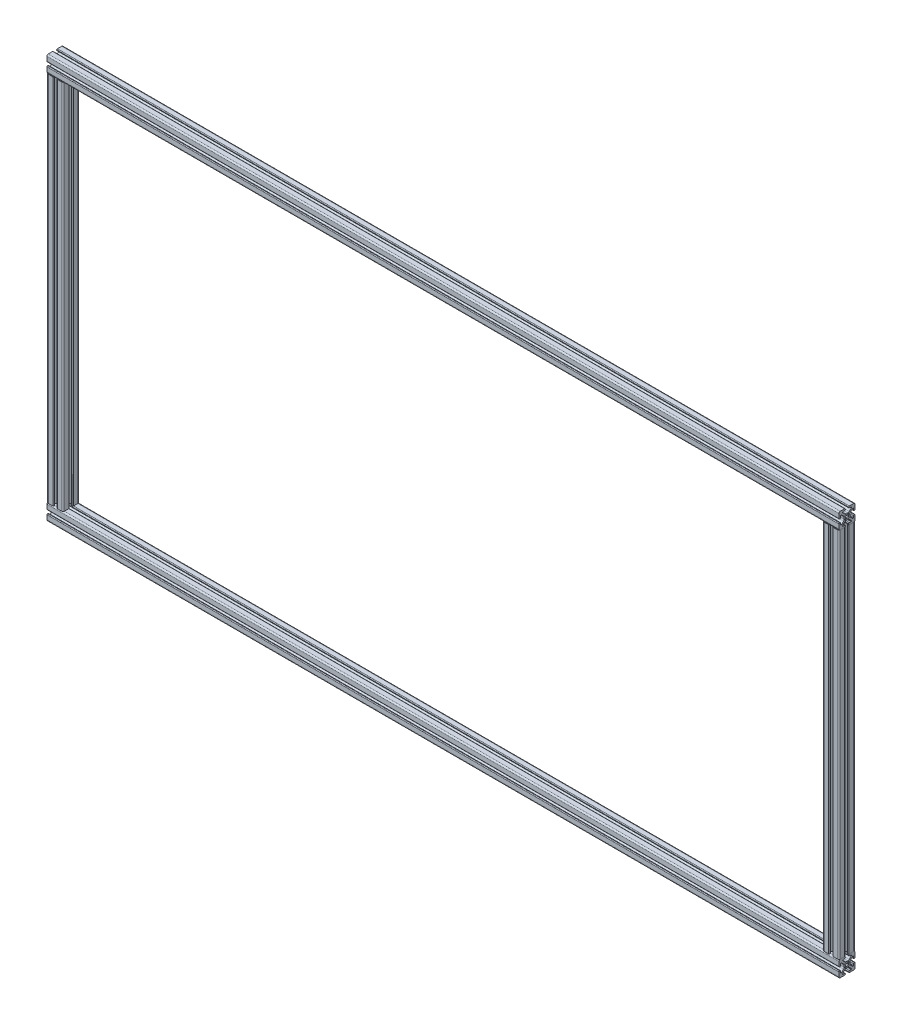
from build123d import *

# Parameters (mm, degrees)
F_15_SERIES_1515_S_BLACK_1_DEPTH      = 1847.85
F_15_SERIES_1515_S_BLACK_1_DEPTH_BACK = 19.05
F_15_SERIES_1515_S_BLACK_1_2_DEPTH    = 1866.9
F_15_SERIES_1515_S_BLACK_1_3_DEPTH    = 916.4
F_15_SERIES_1515_S_BLACK_1_4_DEPTH    = 916.4


with BuildPart() as part:
    # Sketch1 → 15 series 1515-S-BLACK(1) (new, two sides: drawn at the far end of the back side and taken through both)
    with BuildSketch(Plane(origin=(-914.4, 457.2, 0), x_dir=(0, 0, -1), z_dir=(1, 0, 0)).offset(-F_15_SERIES_1515_S_BLACK_1_DEPTH_BACK)):
        with BuildLine():
            Line((-14.986, -9.398), (-14.986, -5.6388))
            ThreePointArc((-14.986, -5.6388), (-15.447248241, -4.525248241), (-16.5608, -4.064))
            Line((-16.5608, -4.064), (-17.4752, -4.064))
            ThreePointArc((-17.4752, -4.064), (-18.588751759, -4.525248241), (-19.05, -5.6388))
            Line((-19.05, -5.6388), (-19.05, -15.875))
            ThreePointArc((-19.05, -15.875), (-18.12006403, -18.12006403), (-15.875, -19.05))
            Line((-15.875, -19.05), (-5.6388, -19.05))
            ThreePointArc((-5.6388, -19.05), (-4.525248241, -18.588751759), (-4.064, -17.4752))
            Line((-4.064, -17.4752), (-4.064, -16.5608))
            ThreePointArc((-4.064, -16.5608), (-4.525248241, -15.447248241), (-5.6388, -14.986))
            Line((-5.6388, -14.986), (-9.398, -14.986))
            ThreePointArc((-9.398, -14.986), (-10.026617928, -14.725617928), (-10.287, -14.097))
            Line((-10.287, -14.097), (-10.287, -13.528918))
            ThreePointArc((-10.287, -13.528918), (-10.219328904, -13.188712428), (-10.026617928, -12.900300071))
            Line((-10.026617928, -12.900300071), (-5.255516832, -8.129198975))
            ThreePointArc((-5.255516832, -8.129198975), (-3.71457081, -7.09957176), (-1.896901043, -6.738014764))
            Line((-1.896901043, -6.738014764), (1.896901043, -6.738014764))
            ThreePointArc((1.896901043, -6.738014764), (3.71457081, -7.09957176), (5.255516832, -8.129198975))
            Line((5.255516832, -8.129198975), (10.026617928, -12.900300071))
            ThreePointArc((10.026617928, -12.900300071), (10.219328904, -13.188712428), (10.287, -13.528918))
            Line((10.287, -13.528918), (10.287, -14.097))
            ThreePointArc((10.287, -14.097), (10.026617928, -14.725617928), (9.398, -14.986))
            Line((9.398, -14.986), (5.6388, -14.986))
            ThreePointArc((5.6388, -14.986), (4.525248241, -15.447248241), (4.064, -16.5608))
            Line((4.064, -16.5608), (4.064, -17.4752))
            ThreePointArc((4.064, -17.4752), (4.525248241, -18.588751759), (5.6388, -19.05))
            Line((5.6388, -19.05), (15.875, -19.05))
            ThreePointArc((15.875, -19.05), (18.12006403, -18.12006403), (19.05, -15.875))
            Line((19.05, -15.875), (19.05, -5.6388))
            ThreePointArc((19.05, -5.6388), (18.588751759, -4.525248241), (17.4752, -4.064))
            Line((17.4752, -4.064), (16.5608, -4.064))
            ThreePointArc((16.5608, -4.064), (15.447248241, -4.525248241), (14.986, -5.6388))
            Line((14.986, -5.6388), (14.986, -9.398))
            ThreePointArc((14.986, -9.398), (14.725617928, -10.026617928), (14.097, -10.287))
            Line((14.097, -10.287), (13.528918, -10.287))
            ThreePointArc((13.528918, -10.287), (13.188712428, -10.219328904), (12.900300071, -10.026617928))
            Line((12.900300071, -10.026617928), (8.129198975, -5.255516832))
            ThreePointArc((8.129198975, -5.255516832), (7.09957176, -3.71457081), (6.738014764, -1.896901043))
            Line((6.738014764, -1.896901043), (6.738014764, 1.896901043))
            ThreePointArc((6.738014764, 1.896901043), (7.09957176, 3.71457081), (8.129198975, 5.255516832))
            Line((8.129198975, 5.255516832), (12.900300071, 10.026617928))
            ThreePointArc((12.900300071, 10.026617928), (13.188712428, 10.219328904), (13.528918, 10.287))
            Line((13.528918, 10.287), (14.097, 10.287))
            ThreePointArc((14.097, 10.287), (14.725617928, 10.026617928), (14.986, 9.398))
            Line((14.986, 9.398), (14.986, 5.6388))
            ThreePointArc((14.986, 5.6388), (15.447248241, 4.525248241), (16.5608, 4.064))
            Line((16.5608, 4.064), (17.4752, 4.064))
            ThreePointArc((17.4752, 4.064), (18.588751759, 4.525248241), (19.05, 5.6388))
            Line((19.05, 5.6388), (19.05, 15.875))
            ThreePointArc((19.05, 15.875), (18.12006403, 18.12006403), (15.875, 19.05))
            Line((15.875, 19.05), (5.6388, 19.05))
            ThreePointArc((5.6388, 19.05), (4.525248241, 18.588751759), (4.064, 17.4752))
            Line((4.064, 17.4752), (4.064, 16.5608))
            ThreePointArc((4.064, 16.5608), (4.525248241, 15.447248241), (5.6388, 14.986))
            Line((5.6388, 14.986), (9.398, 14.986))
            ThreePointArc((9.398, 14.986), (10.026617928, 14.725617928), (10.287, 14.097))
            Line((10.287, 14.097), (10.287, 13.528918))
            ThreePointArc((10.287, 13.528918), (10.219328904, 13.188712428), (10.026617928, 12.900300071))
            Line((10.026617928, 12.900300071), (5.255516832, 8.129198975))
            ThreePointArc((5.255516832, 8.129198975), (3.71457081, 7.09957176), (1.896901043, 6.738014764))
            Line((1.896901043, 6.738014764), (-1.896901043, 6.738014764))
            ThreePointArc((-1.896901043, 6.738014764), (-3.71457081, 7.09957176), (-5.255516832, 8.129198975))
            Line((-5.255516832, 8.129198975), (-10.026617928, 12.900300071))
            ThreePointArc((-10.026617928, 12.900300071), (-10.219328904, 13.188712428), (-10.287, 13.528918))
            Line((-10.287, 13.528918), (-10.287, 14.097))
            ThreePointArc((-10.287, 14.097), (-10.026617928, 14.725617928), (-9.398, 14.986))
            Line((-9.398, 14.986), (-5.6388, 14.986))
            ThreePointArc((-5.6388, 14.986), (-4.525248241, 15.447248241), (-4.064, 16.5608))
            Line((-4.064, 16.5608), (-4.064, 17.4752))
            ThreePointArc((-4.064, 17.4752), (-4.525248241, 18.588751759), (-5.6388, 19.05))
            Line((-5.6388, 19.05), (-15.875, 19.05))
            ThreePointArc((-15.875, 19.05), (-18.12006403, 18.12006403), (-19.05, 15.875))
            Line((-19.05, 15.875), (-19.05, 5.6388))
            ThreePointArc((-19.05, 5.6388), (-18.588751759, 4.525248241), (-17.4752, 4.064))
            Line((-17.4752, 4.064), (-16.5608, 4.064))
            ThreePointArc((-16.5608, 4.064), (-15.447248241, 4.525248241), (-14.986, 5.6388))
            Line((-14.986, 5.6388), (-14.986, 9.398))
            ThreePointArc((-14.986, 9.398), (-14.725617928, 10.026617928), (-14.097, 10.287))
            Line((-14.097, 10.287), (-13.528918, 10.287))
            ThreePointArc((-13.528918, 10.287), (-13.188712428, 10.219328904), (-12.900300071, 10.026617928))
            Line((-12.900300071, 10.026617928), (-8.129198975, 5.255516832))
            ThreePointArc((-8.129198975, 5.255516832), (-7.09957176, 3.71457081), (-6.738014764, 1.896901043))
            Line((-6.738014764, 1.896901043), (-6.738014764, -1.896901043))
            ThreePointArc((-6.738014764, -1.896901043), (-7.09957176, -3.71457081), (-8.129198975, -5.255516832))
            Line((-8.129198975, -5.255516832), (-12.900300071, -10.026617928))
            ThreePointArc((-12.900300071, -10.026617928), (-13.188712428, -10.219328904), (-13.528918, -10.287))
            Line((-13.528918, -10.287), (-14.097, -10.287))
            ThreePointArc((-14.097, -10.287), (-14.725617928, -10.026617928), (-14.986, -9.398))
        make_face()
        with BuildLine():
            Line((-3.017877069, 1.401430967), (-4.338823051, 2.722376949))
            ThreePointArc((-4.338823051, 2.722376949), (-4.338823051, 4.338823051), (-2.722376949, 4.338823051))
            Line((-2.722376949, 4.338823051), (-1.401430967, 3.017877069))
            ThreePointArc((-1.401430967, 3.017877069), (0, 3.3274), (1.401430967, 3.017877069))
            Line((1.401430967, 3.017877069), (2.722376949, 4.338823051))
            ThreePointArc((2.722376949, 4.338823051), (4.338823051, 4.338823051), (4.338823051, 2.722376949))
            Line((4.338823051, 2.722376949), (3.017877069, 1.401430967))
            ThreePointArc((3.017877069, 1.401430967), (3.3274, 0), (3.017877069, -1.401430967))
            Line((3.017877069, -1.401430967), (4.338823051, -2.722376949))
            ThreePointArc((4.338823051, -2.722376949), (4.338823051, -4.338823051), (2.722376949, -4.338823051))
            Line((2.722376949, -4.338823051), (1.401430967, -3.017877069))
            ThreePointArc((1.401430967, -3.017877069), (0, -3.3274), (-1.401430967, -3.017877069))
            Line((-1.401430967, -3.017877069), (-2.722376949, -4.338823051))
            ThreePointArc((-2.722376949, -4.338823051), (-4.338823051, -4.338823051), (-4.338823051, -2.722376949))
            Line((-4.338823051, -2.722376949), (-3.017877069, -1.401430967))
            ThreePointArc((-3.017877069, -1.401430967), (-3.3274, 0), (-3.017877069, 1.401430967))
        make_face(mode=Mode.SUBTRACT)
    extrude(amount=F_15_SERIES_1515_S_BLACK_1_DEPTH + F_15_SERIES_1515_S_BLACK_1_DEPTH_BACK)


with BuildPart() as body_2:
    # Sketch1 on segment 2 (carried to segment 2) → 15 series 1515-S-BLACK_1 2 (new body)
    with BuildSketch(Plane(origin=(-933.45, -457.2, 0), x_dir=(0, 0, -1), z_dir=(1, 0, 0))):
        with BuildLine():
            Line((-14.986, -9.398), (-14.986, -5.6388))
            ThreePointArc((-14.986, -5.6388), (-15.447248241, -4.525248241), (-16.5608, -4.064))
            Line((-16.5608, -4.064), (-17.4752, -4.064))
            ThreePointArc((-17.4752, -4.064), (-18.588751759, -4.525248241), (-19.05, -5.6388))
            Line((-19.05, -5.6388), (-19.05, -15.875))
            ThreePointArc((-19.05, -15.875), (-18.12006403, -18.12006403), (-15.875, -19.05))
            Line((-15.875, -19.05), (-5.6388, -19.05))
            ThreePointArc((-5.6388, -19.05), (-4.525248241, -18.588751759), (-4.064, -17.4752))
            Line((-4.064, -17.4752), (-4.064, -16.5608))
            ThreePointArc((-4.064, -16.5608), (-4.525248241, -15.447248241), (-5.6388, -14.986))
            Line((-5.6388, -14.986), (-9.398, -14.986))
            ThreePointArc((-9.398, -14.986), (-10.026617928, -14.725617928), (-10.287, -14.097))
            Line((-10.287, -14.097), (-10.287, -13.528918))
            ThreePointArc((-10.287, -13.528918), (-10.219328904, -13.188712428), (-10.026617928, -12.900300071))
            Line((-10.026617928, -12.900300071), (-5.255516832, -8.129198975))
            ThreePointArc((-5.255516832, -8.129198975), (-3.71457081, -7.09957176), (-1.896901043, -6.738014764))
            Line((-1.896901043, -6.738014764), (1.896901043, -6.738014764))
            ThreePointArc((1.896901043, -6.738014764), (3.71457081, -7.09957176), (5.255516832, -8.129198975))
            Line((5.255516832, -8.129198975), (10.026617928, -12.900300071))
            ThreePointArc((10.026617928, -12.900300071), (10.219328904, -13.188712428), (10.287, -13.528918))
            Line((10.287, -13.528918), (10.287, -14.097))
            ThreePointArc((10.287, -14.097), (10.026617928, -14.725617928), (9.398, -14.986))
            Line((9.398, -14.986), (5.6388, -14.986))
            ThreePointArc((5.6388, -14.986), (4.525248241, -15.447248241), (4.064, -16.5608))
            Line((4.064, -16.5608), (4.064, -17.4752))
            ThreePointArc((4.064, -17.4752), (4.525248241, -18.588751759), (5.6388, -19.05))
            Line((5.6388, -19.05), (15.875, -19.05))
            ThreePointArc((15.875, -19.05), (18.12006403, -18.12006403), (19.05, -15.875))
            Line((19.05, -15.875), (19.05, -5.6388))
            ThreePointArc((19.05, -5.6388), (18.588751759, -4.525248241), (17.4752, -4.064))
            Line((17.4752, -4.064), (16.5608, -4.064))
            ThreePointArc((16.5608, -4.064), (15.447248241, -4.525248241), (14.986, -5.6388))
            Line((14.986, -5.6388), (14.986, -9.398))
            ThreePointArc((14.986, -9.398), (14.725617928, -10.026617928), (14.097, -10.287))
            Line((14.097, -10.287), (13.528918, -10.287))
            ThreePointArc((13.528918, -10.287), (13.188712428, -10.219328904), (12.900300071, -10.026617928))
            Line((12.900300071, -10.026617928), (8.129198975, -5.255516832))
            ThreePointArc((8.129198975, -5.255516832), (7.09957176, -3.71457081), (6.738014764, -1.896901043))
            Line((6.738014764, -1.896901043), (6.738014764, 1.896901043))
            ThreePointArc((6.738014764, 1.896901043), (7.09957176, 3.71457081), (8.129198975, 5.255516832))
            Line((8.129198975, 5.255516832), (12.900300071, 10.026617928))
            ThreePointArc((12.900300071, 10.026617928), (13.188712428, 10.219328904), (13.528918, 10.287))
            Line((13.528918, 10.287), (14.097, 10.287))
            ThreePointArc((14.097, 10.287), (14.725617928, 10.026617928), (14.986, 9.398))
            Line((14.986, 9.398), (14.986, 5.6388))
            ThreePointArc((14.986, 5.6388), (15.447248241, 4.525248241), (16.5608, 4.064))
            Line((16.5608, 4.064), (17.4752, 4.064))
            ThreePointArc((17.4752, 4.064), (18.588751759, 4.525248241), (19.05, 5.6388))
            Line((19.05, 5.6388), (19.05, 15.875))
            ThreePointArc((19.05, 15.875), (18.12006403, 18.12006403), (15.875, 19.05))
            Line((15.875, 19.05), (5.6388, 19.05))
            ThreePointArc((5.6388, 19.05), (4.525248241, 18.588751759), (4.064, 17.4752))
            Line((4.064, 17.4752), (4.064, 16.5608))
            ThreePointArc((4.064, 16.5608), (4.525248241, 15.447248241), (5.6388, 14.986))
            Line((5.6388, 14.986), (9.398, 14.986))
            ThreePointArc((9.398, 14.986), (10.026617928, 14.725617928), (10.287, 14.097))
            Line((10.287, 14.097), (10.287, 13.528918))
            ThreePointArc((10.287, 13.528918), (10.219328904, 13.188712428), (10.026617928, 12.900300071))
            Line((10.026617928, 12.900300071), (5.255516832, 8.129198975))
            ThreePointArc((5.255516832, 8.129198975), (3.71457081, 7.09957176), (1.896901043, 6.738014764))
            Line((1.896901043, 6.738014764), (-1.896901043, 6.738014764))
            ThreePointArc((-1.896901043, 6.738014764), (-3.71457081, 7.09957176), (-5.255516832, 8.129198975))
            Line((-5.255516832, 8.129198975), (-10.026617928, 12.900300071))
            ThreePointArc((-10.026617928, 12.900300071), (-10.219328904, 13.188712428), (-10.287, 13.528918))
            Line((-10.287, 13.528918), (-10.287, 14.097))
            ThreePointArc((-10.287, 14.097), (-10.026617928, 14.725617928), (-9.398, 14.986))
            Line((-9.398, 14.986), (-5.6388, 14.986))
            ThreePointArc((-5.6388, 14.986), (-4.525248241, 15.447248241), (-4.064, 16.5608))
            Line((-4.064, 16.5608), (-4.064, 17.4752))
            ThreePointArc((-4.064, 17.4752), (-4.525248241, 18.588751759), (-5.6388, 19.05))
            Line((-5.6388, 19.05), (-15.875, 19.05))
            ThreePointArc((-15.875, 19.05), (-18.12006403, 18.12006403), (-19.05, 15.875))
            Line((-19.05, 15.875), (-19.05, 5.6388))
            ThreePointArc((-19.05, 5.6388), (-18.588751759, 4.525248241), (-17.4752, 4.064))
            Line((-17.4752, 4.064), (-16.5608, 4.064))
            ThreePointArc((-16.5608, 4.064), (-15.447248241, 4.525248241), (-14.986, 5.6388))
            Line((-14.986, 5.6388), (-14.986, 9.398))
            ThreePointArc((-14.986, 9.398), (-14.725617928, 10.026617928), (-14.097, 10.287))
            Line((-14.097, 10.287), (-13.528918, 10.287))
            ThreePointArc((-13.528918, 10.287), (-13.188712428, 10.219328904), (-12.900300071, 10.026617928))
            Line((-12.900300071, 10.026617928), (-8.129198975, 5.255516832))
            ThreePointArc((-8.129198975, 5.255516832), (-7.09957176, 3.71457081), (-6.738014764, 1.896901043))
            Line((-6.738014764, 1.896901043), (-6.738014764, -1.896901043))
            ThreePointArc((-6.738014764, -1.896901043), (-7.09957176, -3.71457081), (-8.129198975, -5.255516832))
            Line((-8.129198975, -5.255516832), (-12.900300071, -10.026617928))
            ThreePointArc((-12.900300071, -10.026617928), (-13.188712428, -10.219328904), (-13.528918, -10.287))
            Line((-13.528918, -10.287), (-14.097, -10.287))
            ThreePointArc((-14.097, -10.287), (-14.725617928, -10.026617928), (-14.986, -9.398))
        make_face()
        with BuildLine():
            Line((-3.017877069, 1.401430967), (-4.338823051, 2.722376949))
            ThreePointArc((-4.338823051, 2.722376949), (-4.338823051, 4.338823051), (-2.722376949, 4.338823051))
            Line((-2.722376949, 4.338823051), (-1.401430967, 3.017877069))
            ThreePointArc((-1.401430967, 3.017877069), (0, 3.3274), (1.401430967, 3.017877069))
            Line((1.401430967, 3.017877069), (2.722376949, 4.338823051))
            ThreePointArc((2.722376949, 4.338823051), (4.338823051, 4.338823051), (4.338823051, 2.722376949))
            Line((4.338823051, 2.722376949), (3.017877069, 1.401430967))
            ThreePointArc((3.017877069, 1.401430967), (3.3274, 0), (3.017877069, -1.401430967))
            Line((3.017877069, -1.401430967), (4.338823051, -2.722376949))
            ThreePointArc((4.338823051, -2.722376949), (4.338823051, -4.338823051), (2.722376949, -4.338823051))
            Line((2.722376949, -4.338823051), (1.401430967, -3.017877069))
            ThreePointArc((1.401430967, -3.017877069), (0, -3.3274), (-1.401430967, -3.017877069))
            Line((-1.401430967, -3.017877069), (-2.722376949, -4.338823051))
            ThreePointArc((-2.722376949, -4.338823051), (-4.338823051, -4.338823051), (-4.338823051, -2.722376949))
            Line((-4.338823051, -2.722376949), (-3.017877069, -1.401430967))
            ThreePointArc((-3.017877069, -1.401430967), (-3.3274, 0), (-3.017877069, 1.401430967))
        make_face(mode=Mode.SUBTRACT)
    extrude(amount=F_15_SERIES_1515_S_BLACK_1_2_DEPTH)


with BuildPart() as body_3:
    # Sketch1 on segment 3 (carried to segment 3) → 15 series 1515-S-BLACK_1 3 (new body)
    with BuildSketch(Plane(origin=(-914.4, -458.2, 0), x_dir=(0, 0, -1), z_dir=(0, 1, 0))):
        with BuildLine():
            Line((-14.986, -9.398), (-14.986, -5.6388))
            ThreePointArc((-14.986, -5.6388), (-15.447248241, -4.525248241), (-16.5608, -4.064))
            Line((-16.5608, -4.064), (-17.4752, -4.064))
            ThreePointArc((-17.4752, -4.064), (-18.588751759, -4.525248241), (-19.05, -5.6388))
            Line((-19.05, -5.6388), (-19.05, -15.875))
            ThreePointArc((-19.05, -15.875), (-18.12006403, -18.12006403), (-15.875, -19.05))
            Line((-15.875, -19.05), (-5.6388, -19.05))
            ThreePointArc((-5.6388, -19.05), (-4.525248241, -18.588751759), (-4.064, -17.4752))
            Line((-4.064, -17.4752), (-4.064, -16.5608))
            ThreePointArc((-4.064, -16.5608), (-4.525248241, -15.447248241), (-5.6388, -14.986))
            Line((-5.6388, -14.986), (-9.398, -14.986))
            ThreePointArc((-9.398, -14.986), (-10.026617928, -14.725617928), (-10.287, -14.097))
            Line((-10.287, -14.097), (-10.287, -13.528918))
            ThreePointArc((-10.287, -13.528918), (-10.219328904, -13.188712428), (-10.026617928, -12.900300071))
            Line((-10.026617928, -12.900300071), (-5.255516832, -8.129198975))
            ThreePointArc((-5.255516832, -8.129198975), (-3.71457081, -7.09957176), (-1.896901043, -6.738014764))
            Line((-1.896901043, -6.738014764), (1.896901043, -6.738014764))
            ThreePointArc((1.896901043, -6.738014764), (3.71457081, -7.09957176), (5.255516832, -8.129198975))
            Line((5.255516832, -8.129198975), (10.026617928, -12.900300071))
            ThreePointArc((10.026617928, -12.900300071), (10.219328904, -13.188712428), (10.287, -13.528918))
            Line((10.287, -13.528918), (10.287, -14.097))
            ThreePointArc((10.287, -14.097), (10.026617928, -14.725617928), (9.398, -14.986))
            Line((9.398, -14.986), (5.6388, -14.986))
            ThreePointArc((5.6388, -14.986), (4.525248241, -15.447248241), (4.064, -16.5608))
            Line((4.064, -16.5608), (4.064, -17.4752))
            ThreePointArc((4.064, -17.4752), (4.525248241, -18.588751759), (5.6388, -19.05))
            Line((5.6388, -19.05), (15.875, -19.05))
            ThreePointArc((15.875, -19.05), (18.12006403, -18.12006403), (19.05, -15.875))
            Line((19.05, -15.875), (19.05, -5.6388))
            ThreePointArc((19.05, -5.6388), (18.588751759, -4.525248241), (17.4752, -4.064))
            Line((17.4752, -4.064), (16.5608, -4.064))
            ThreePointArc((16.5608, -4.064), (15.447248241, -4.525248241), (14.986, -5.6388))
            Line((14.986, -5.6388), (14.986, -9.398))
            ThreePointArc((14.986, -9.398), (14.725617928, -10.026617928), (14.097, -10.287))
            Line((14.097, -10.287), (13.528918, -10.287))
            ThreePointArc((13.528918, -10.287), (13.188712428, -10.219328904), (12.900300071, -10.026617928))
            Line((12.900300071, -10.026617928), (8.129198975, -5.255516832))
            ThreePointArc((8.129198975, -5.255516832), (7.09957176, -3.71457081), (6.738014764, -1.896901043))
            Line((6.738014764, -1.896901043), (6.738014764, 1.896901043))
            ThreePointArc((6.738014764, 1.896901043), (7.09957176, 3.71457081), (8.129198975, 5.255516832))
            Line((8.129198975, 5.255516832), (12.900300071, 10.026617928))
            ThreePointArc((12.900300071, 10.026617928), (13.188712428, 10.219328904), (13.528918, 10.287))
            Line((13.528918, 10.287), (14.097, 10.287))
            ThreePointArc((14.097, 10.287), (14.725617928, 10.026617928), (14.986, 9.398))
            Line((14.986, 9.398), (14.986, 5.6388))
            ThreePointArc((14.986, 5.6388), (15.447248241, 4.525248241), (16.5608, 4.064))
            Line((16.5608, 4.064), (17.4752, 4.064))
            ThreePointArc((17.4752, 4.064), (18.588751759, 4.525248241), (19.05, 5.6388))
            Line((19.05, 5.6388), (19.05, 15.875))
            ThreePointArc((19.05, 15.875), (18.12006403, 18.12006403), (15.875, 19.05))
            Line((15.875, 19.05), (5.6388, 19.05))
            ThreePointArc((5.6388, 19.05), (4.525248241, 18.588751759), (4.064, 17.4752))
            Line((4.064, 17.4752), (4.064, 16.5608))
            ThreePointArc((4.064, 16.5608), (4.525248241, 15.447248241), (5.6388, 14.986))
            Line((5.6388, 14.986), (9.398, 14.986))
            ThreePointArc((9.398, 14.986), (10.026617928, 14.725617928), (10.287, 14.097))
            Line((10.287, 14.097), (10.287, 13.528918))
            ThreePointArc((10.287, 13.528918), (10.219328904, 13.188712428), (10.026617928, 12.900300071))
            Line((10.026617928, 12.900300071), (5.255516832, 8.129198975))
            ThreePointArc((5.255516832, 8.129198975), (3.71457081, 7.09957176), (1.896901043, 6.738014764))
            Line((1.896901043, 6.738014764), (-1.896901043, 6.738014764))
            ThreePointArc((-1.896901043, 6.738014764), (-3.71457081, 7.09957176), (-5.255516832, 8.129198975))
            Line((-5.255516832, 8.129198975), (-10.026617928, 12.900300071))
            ThreePointArc((-10.026617928, 12.900300071), (-10.219328904, 13.188712428), (-10.287, 13.528918))
            Line((-10.287, 13.528918), (-10.287, 14.097))
            ThreePointArc((-10.287, 14.097), (-10.026617928, 14.725617928), (-9.398, 14.986))
            Line((-9.398, 14.986), (-5.6388, 14.986))
            ThreePointArc((-5.6388, 14.986), (-4.525248241, 15.447248241), (-4.064, 16.5608))
            Line((-4.064, 16.5608), (-4.064, 17.4752))
            ThreePointArc((-4.064, 17.4752), (-4.525248241, 18.588751759), (-5.6388, 19.05))
            Line((-5.6388, 19.05), (-15.875, 19.05))
            ThreePointArc((-15.875, 19.05), (-18.12006403, 18.12006403), (-19.05, 15.875))
            Line((-19.05, 15.875), (-19.05, 5.6388))
            ThreePointArc((-19.05, 5.6388), (-18.588751759, 4.525248241), (-17.4752, 4.064))
            Line((-17.4752, 4.064), (-16.5608, 4.064))
            ThreePointArc((-16.5608, 4.064), (-15.447248241, 4.525248241), (-14.986, 5.6388))
            Line((-14.986, 5.6388), (-14.986, 9.398))
            ThreePointArc((-14.986, 9.398), (-14.725617928, 10.026617928), (-14.097, 10.287))
            Line((-14.097, 10.287), (-13.528918, 10.287))
            ThreePointArc((-13.528918, 10.287), (-13.188712428, 10.219328904), (-12.900300071, 10.026617928))
            Line((-12.900300071, 10.026617928), (-8.129198975, 5.255516832))
            ThreePointArc((-8.129198975, 5.255516832), (-7.09957176, 3.71457081), (-6.738014764, 1.896901043))
            Line((-6.738014764, 1.896901043), (-6.738014764, -1.896901043))
            ThreePointArc((-6.738014764, -1.896901043), (-7.09957176, -3.71457081), (-8.129198975, -5.255516832))
            Line((-8.129198975, -5.255516832), (-12.900300071, -10.026617928))
            ThreePointArc((-12.900300071, -10.026617928), (-13.188712428, -10.219328904), (-13.528918, -10.287))
            Line((-13.528918, -10.287), (-14.097, -10.287))
            ThreePointArc((-14.097, -10.287), (-14.725617928, -10.026617928), (-14.986, -9.398))
        make_face()
        with BuildLine():
            Line((-3.017877069, 1.401430967), (-4.338823051, 2.722376949))
            ThreePointArc((-4.338823051, 2.722376949), (-4.338823051, 4.338823051), (-2.722376949, 4.338823051))
            Line((-2.722376949, 4.338823051), (-1.401430967, 3.017877069))
            ThreePointArc((-1.401430967, 3.017877069), (0, 3.3274), (1.401430967, 3.017877069))
            Line((1.401430967, 3.017877069), (2.722376949, 4.338823051))
            ThreePointArc((2.722376949, 4.338823051), (4.338823051, 4.338823051), (4.338823051, 2.722376949))
            Line((4.338823051, 2.722376949), (3.017877069, 1.401430967))
            ThreePointArc((3.017877069, 1.401430967), (3.3274, 0), (3.017877069, -1.401430967))
            Line((3.017877069, -1.401430967), (4.338823051, -2.722376949))
            ThreePointArc((4.338823051, -2.722376949), (4.338823051, -4.338823051), (2.722376949, -4.338823051))
            Line((2.722376949, -4.338823051), (1.401430967, -3.017877069))
            ThreePointArc((1.401430967, -3.017877069), (0, -3.3274), (-1.401430967, -3.017877069))
            Line((-1.401430967, -3.017877069), (-2.722376949, -4.338823051))
            ThreePointArc((-2.722376949, -4.338823051), (-4.338823051, -4.338823051), (-4.338823051, -2.722376949))
            Line((-4.338823051, -2.722376949), (-3.017877069, -1.401430967))
            ThreePointArc((-3.017877069, -1.401430967), (-3.3274, 0), (-3.017877069, 1.401430967))
        make_face(mode=Mode.SUBTRACT)
    extrude(amount=F_15_SERIES_1515_S_BLACK_1_3_DEPTH)

    # 15 series 1515-S-BLACK_1 3 end butt 1
    split(bisect_by=Plane(origin=(-914.4, -438.15, 0), x_dir=(-1, 0, 0), z_dir=(0, 1, 0)), keep=Keep.TOP)

    # 15 series 1515-S-BLACK_1 3 end butt 2
    split(bisect_by=Plane(origin=(-914.4, 438.15, 0), x_dir=(1, 0, 0), z_dir=(0, -1, 0)), keep=Keep.TOP)


with BuildPart() as body_4:
    # Sketch1 on segment 4 (carried to segment 4) → 15 series 1515-S-BLACK_1 4 (new body)
    with BuildSketch(Plane(origin=(914.4, -458.2, 0), x_dir=(0, 0, -1), z_dir=(0, 1, 0))):
        with BuildLine():
            Line((-14.986, -9.398), (-14.986, -5.6388))
            ThreePointArc((-14.986, -5.6388), (-15.447248241, -4.525248241), (-16.5608, -4.064))
            Line((-16.5608, -4.064), (-17.4752, -4.064))
            ThreePointArc((-17.4752, -4.064), (-18.588751759, -4.525248241), (-19.05, -5.6388))
            Line((-19.05, -5.6388), (-19.05, -15.875))
            ThreePointArc((-19.05, -15.875), (-18.12006403, -18.12006403), (-15.875, -19.05))
            Line((-15.875, -19.05), (-5.6388, -19.05))
            ThreePointArc((-5.6388, -19.05), (-4.525248241, -18.588751759), (-4.064, -17.4752))
            Line((-4.064, -17.4752), (-4.064, -16.5608))
            ThreePointArc((-4.064, -16.5608), (-4.525248241, -15.447248241), (-5.6388, -14.986))
            Line((-5.6388, -14.986), (-9.398, -14.986))
            ThreePointArc((-9.398, -14.986), (-10.026617928, -14.725617928), (-10.287, -14.097))
            Line((-10.287, -14.097), (-10.287, -13.528918))
            ThreePointArc((-10.287, -13.528918), (-10.219328904, -13.188712428), (-10.026617928, -12.900300071))
            Line((-10.026617928, -12.900300071), (-5.255516832, -8.129198975))
            ThreePointArc((-5.255516832, -8.129198975), (-3.71457081, -7.09957176), (-1.896901043, -6.738014764))
            Line((-1.896901043, -6.738014764), (1.896901043, -6.738014764))
            ThreePointArc((1.896901043, -6.738014764), (3.71457081, -7.09957176), (5.255516832, -8.129198975))
            Line((5.255516832, -8.129198975), (10.026617928, -12.900300071))
            ThreePointArc((10.026617928, -12.900300071), (10.219328904, -13.188712428), (10.287, -13.528918))
            Line((10.287, -13.528918), (10.287, -14.097))
            ThreePointArc((10.287, -14.097), (10.026617928, -14.725617928), (9.398, -14.986))
            Line((9.398, -14.986), (5.6388, -14.986))
            ThreePointArc((5.6388, -14.986), (4.525248241, -15.447248241), (4.064, -16.5608))
            Line((4.064, -16.5608), (4.064, -17.4752))
            ThreePointArc((4.064, -17.4752), (4.525248241, -18.588751759), (5.6388, -19.05))
            Line((5.6388, -19.05), (15.875, -19.05))
            ThreePointArc((15.875, -19.05), (18.12006403, -18.12006403), (19.05, -15.875))
            Line((19.05, -15.875), (19.05, -5.6388))
            ThreePointArc((19.05, -5.6388), (18.588751759, -4.525248241), (17.4752, -4.064))
            Line((17.4752, -4.064), (16.5608, -4.064))
            ThreePointArc((16.5608, -4.064), (15.447248241, -4.525248241), (14.986, -5.6388))
            Line((14.986, -5.6388), (14.986, -9.398))
            ThreePointArc((14.986, -9.398), (14.725617928, -10.026617928), (14.097, -10.287))
            Line((14.097, -10.287), (13.528918, -10.287))
            ThreePointArc((13.528918, -10.287), (13.188712428, -10.219328904), (12.900300071, -10.026617928))
            Line((12.900300071, -10.026617928), (8.129198975, -5.255516832))
            ThreePointArc((8.129198975, -5.255516832), (7.09957176, -3.71457081), (6.738014764, -1.896901043))
            Line((6.738014764, -1.896901043), (6.738014764, 1.896901043))
            ThreePointArc((6.738014764, 1.896901043), (7.09957176, 3.71457081), (8.129198975, 5.255516832))
            Line((8.129198975, 5.255516832), (12.900300071, 10.026617928))
            ThreePointArc((12.900300071, 10.026617928), (13.188712428, 10.219328904), (13.528918, 10.287))
            Line((13.528918, 10.287), (14.097, 10.287))
            ThreePointArc((14.097, 10.287), (14.725617928, 10.026617928), (14.986, 9.398))
            Line((14.986, 9.398), (14.986, 5.6388))
            ThreePointArc((14.986, 5.6388), (15.447248241, 4.525248241), (16.5608, 4.064))
            Line((16.5608, 4.064), (17.4752, 4.064))
            ThreePointArc((17.4752, 4.064), (18.588751759, 4.525248241), (19.05, 5.6388))
            Line((19.05, 5.6388), (19.05, 15.875))
            ThreePointArc((19.05, 15.875), (18.12006403, 18.12006403), (15.875, 19.05))
            Line((15.875, 19.05), (5.6388, 19.05))
            ThreePointArc((5.6388, 19.05), (4.525248241, 18.588751759), (4.064, 17.4752))
            Line((4.064, 17.4752), (4.064, 16.5608))
            ThreePointArc((4.064, 16.5608), (4.525248241, 15.447248241), (5.6388, 14.986))
            Line((5.6388, 14.986), (9.398, 14.986))
            ThreePointArc((9.398, 14.986), (10.026617928, 14.725617928), (10.287, 14.097))
            Line((10.287, 14.097), (10.287, 13.528918))
            ThreePointArc((10.287, 13.528918), (10.219328904, 13.188712428), (10.026617928, 12.900300071))
            Line((10.026617928, 12.900300071), (5.255516832, 8.129198975))
            ThreePointArc((5.255516832, 8.129198975), (3.71457081, 7.09957176), (1.896901043, 6.738014764))
            Line((1.896901043, 6.738014764), (-1.896901043, 6.738014764))
            ThreePointArc((-1.896901043, 6.738014764), (-3.71457081, 7.09957176), (-5.255516832, 8.129198975))
            Line((-5.255516832, 8.129198975), (-10.026617928, 12.900300071))
            ThreePointArc((-10.026617928, 12.900300071), (-10.219328904, 13.188712428), (-10.287, 13.528918))
            Line((-10.287, 13.528918), (-10.287, 14.097))
            ThreePointArc((-10.287, 14.097), (-10.026617928, 14.725617928), (-9.398, 14.986))
            Line((-9.398, 14.986), (-5.6388, 14.986))
            ThreePointArc((-5.6388, 14.986), (-4.525248241, 15.447248241), (-4.064, 16.5608))
            Line((-4.064, 16.5608), (-4.064, 17.4752))
            ThreePointArc((-4.064, 17.4752), (-4.525248241, 18.588751759), (-5.6388, 19.05))
            Line((-5.6388, 19.05), (-15.875, 19.05))
            ThreePointArc((-15.875, 19.05), (-18.12006403, 18.12006403), (-19.05, 15.875))
            Line((-19.05, 15.875), (-19.05, 5.6388))
            ThreePointArc((-19.05, 5.6388), (-18.588751759, 4.525248241), (-17.4752, 4.064))
            Line((-17.4752, 4.064), (-16.5608, 4.064))
            ThreePointArc((-16.5608, 4.064), (-15.447248241, 4.525248241), (-14.986, 5.6388))
            Line((-14.986, 5.6388), (-14.986, 9.398))
            ThreePointArc((-14.986, 9.398), (-14.725617928, 10.026617928), (-14.097, 10.287))
            Line((-14.097, 10.287), (-13.528918, 10.287))
            ThreePointArc((-13.528918, 10.287), (-13.188712428, 10.219328904), (-12.900300071, 10.026617928))
            Line((-12.900300071, 10.026617928), (-8.129198975, 5.255516832))
            ThreePointArc((-8.129198975, 5.255516832), (-7.09957176, 3.71457081), (-6.738014764, 1.896901043))
            Line((-6.738014764, 1.896901043), (-6.738014764, -1.896901043))
            ThreePointArc((-6.738014764, -1.896901043), (-7.09957176, -3.71457081), (-8.129198975, -5.255516832))
            Line((-8.129198975, -5.255516832), (-12.900300071, -10.026617928))
            ThreePointArc((-12.900300071, -10.026617928), (-13.188712428, -10.219328904), (-13.528918, -10.287))
            Line((-13.528918, -10.287), (-14.097, -10.287))
            ThreePointArc((-14.097, -10.287), (-14.725617928, -10.026617928), (-14.986, -9.398))
        make_face()
        with BuildLine():
            Line((-3.017877069, 1.401430967), (-4.338823051, 2.722376949))
            ThreePointArc((-4.338823051, 2.722376949), (-4.338823051, 4.338823051), (-2.722376949, 4.338823051))
            Line((-2.722376949, 4.338823051), (-1.401430967, 3.017877069))
            ThreePointArc((-1.401430967, 3.017877069), (0, 3.3274), (1.401430967, 3.017877069))
            Line((1.401430967, 3.017877069), (2.722376949, 4.338823051))
            ThreePointArc((2.722376949, 4.338823051), (4.338823051, 4.338823051), (4.338823051, 2.722376949))
            Line((4.338823051, 2.722376949), (3.017877069, 1.401430967))
            ThreePointArc((3.017877069, 1.401430967), (3.3274, 0), (3.017877069, -1.401430967))
            Line((3.017877069, -1.401430967), (4.338823051, -2.722376949))
            ThreePointArc((4.338823051, -2.722376949), (4.338823051, -4.338823051), (2.722376949, -4.338823051))
            Line((2.722376949, -4.338823051), (1.401430967, -3.017877069))
            ThreePointArc((1.401430967, -3.017877069), (0, -3.3274), (-1.401430967, -3.017877069))
            Line((-1.401430967, -3.017877069), (-2.722376949, -4.338823051))
            ThreePointArc((-2.722376949, -4.338823051), (-4.338823051, -4.338823051), (-4.338823051, -2.722376949))
            Line((-4.338823051, -2.722376949), (-3.017877069, -1.401430967))
            ThreePointArc((-3.017877069, -1.401430967), (-3.3274, 0), (-3.017877069, 1.401430967))
        make_face(mode=Mode.SUBTRACT)
    extrude(amount=F_15_SERIES_1515_S_BLACK_1_4_DEPTH)

    # 15 series 1515-S-BLACK_1 4 end butt 1
    split(bisect_by=Plane(origin=(914.4, -438.15, 0), x_dir=(-1, 0, 0), z_dir=(0, 1, 0)), keep=Keep.TOP)

    # 15 series 1515-S-BLACK_1 4 end butt 2
    split(bisect_by=Plane(origin=(914.4, 438.15, 0), x_dir=(1, 0, 0), z_dir=(0, -1, 0)), keep=Keep.TOP)


solid = Compound([part.part, body_2.part, body_3.part, body_4.part])
